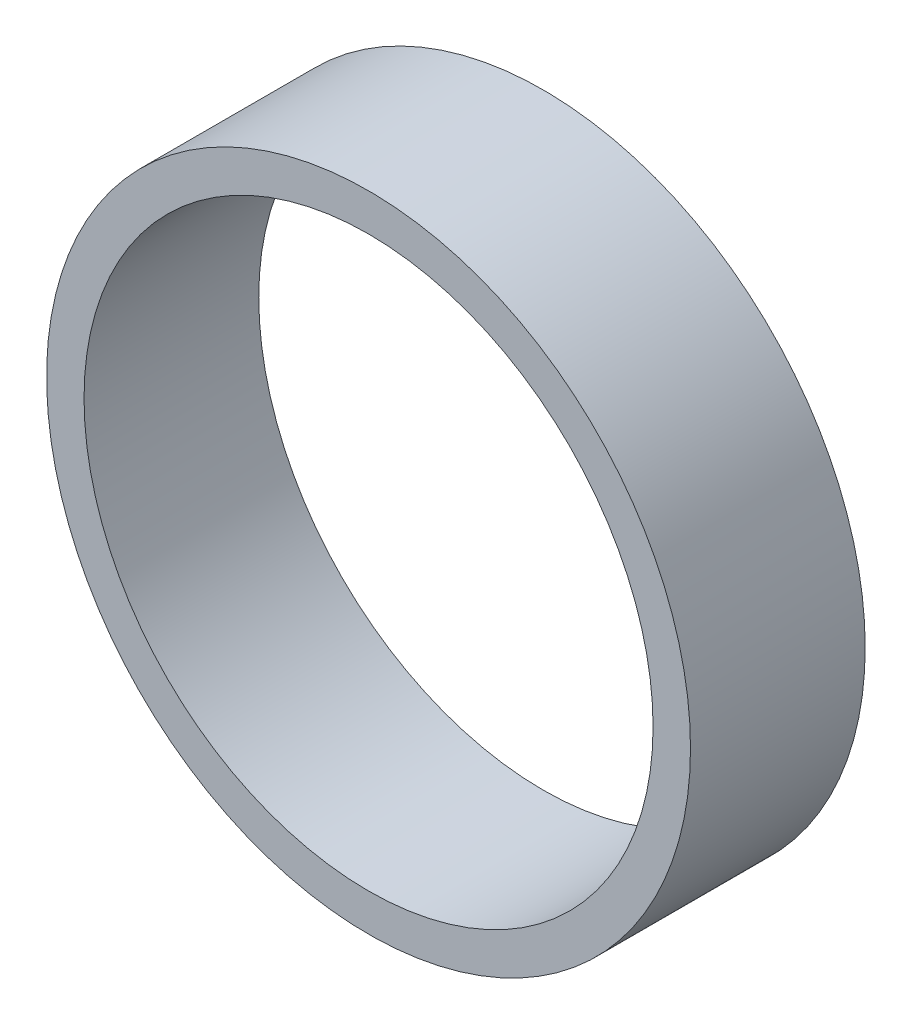
from build123d import *

# Parameters (mm, degrees)
SKETCH1_R           = 6.45
SKETCH1_R_2         = 5.7
RING_ENVELOPE_DEPTH = 3.5


with BuildPart() as part:
    # Sketch1 → Ring_Envelope (new body)
    with BuildSketch(Plane.XY):
        Circle(SKETCH1_R)
        Circle(SKETCH1_R_2, mode=Mode.SUBTRACT)
    extrude(amount=RING_ENVELOPE_DEPTH)


solid = part.part
